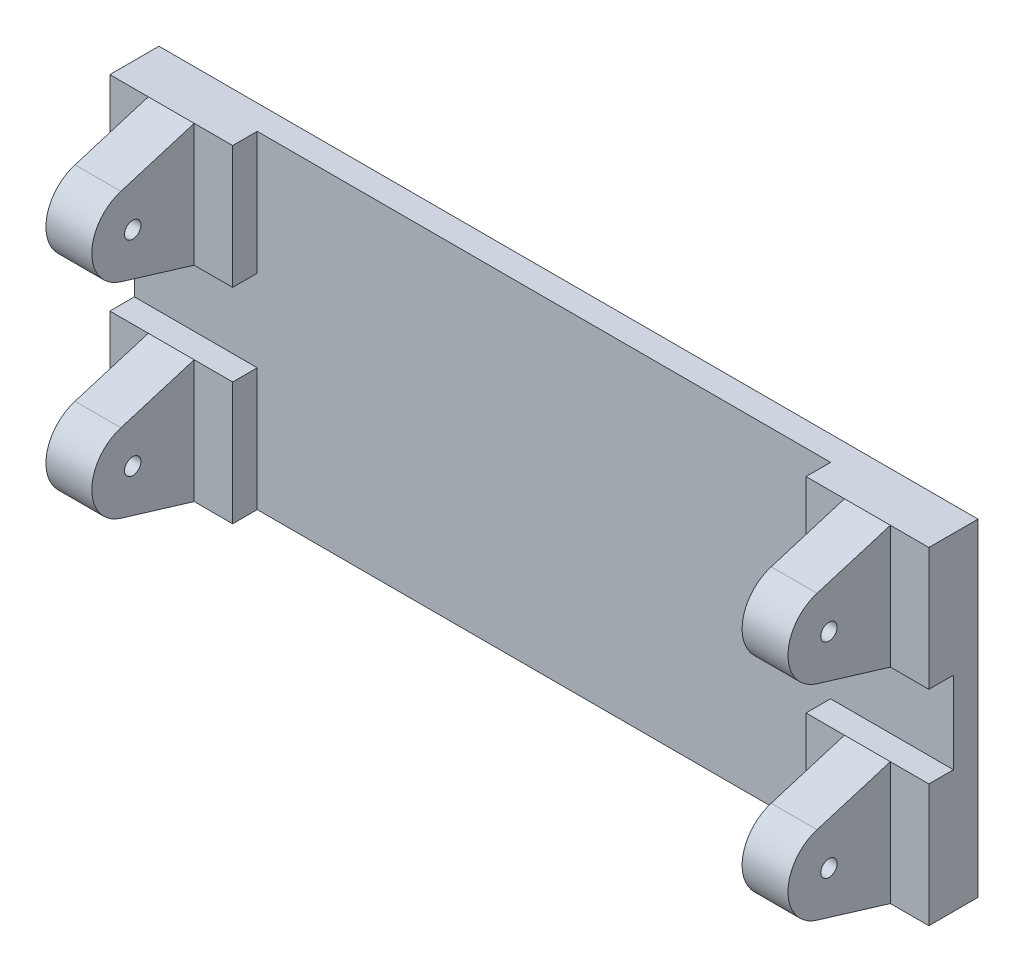
from build123d import *

# Parameters (mm, degrees)
SKETCH1_W               = 100
SKETCH1_H               = 40
BOSS_EXTRUDE1_DEPTH     = 3
SKETCH2_W               = 15
SKETCH2_H               = 15
BOSS_EXTRUDE2_DEPTH     = 3
SKETCH3_R               = 1
BOSS_EXTRUDE3_DEPTH     = 15
CUT_EXTRUDE1_REACH      = 68.65
SKETCH4_W               = 4.7
SKETCH4_H               = 12.5
MIRROR2_COPY_1_SKETCH_R = 1
MIRROR2_COPY_1_DEPTH    = 15
MIRROR2_COPY_2_REACH    = 68.65
MIRROR2_COPY_2_SKETCH_W = 4.7
MIRROR2_COPY_2_SKETCH_H = 12.5


with BuildPart() as part:
    # Sketch1 → Boss-Extrude1 (new body)
    with BuildSketch(Plane.XY):
        Rectangle(SKETCH1_W, SKETCH1_H)
    extrude(amount=BOSS_EXTRUDE1_DEPTH)

    # Sketch2 → Boss-Extrude2 (add)
    with BuildSketch(Plane.XY.offset(3)):
        with Locations((-42.5, 12.5)):
            Rectangle(SKETCH2_W, SKETCH2_H)
        with Locations((-42.5, -12.5)):
            Rectangle(SKETCH2_W, SKETCH2_H)
        with Locations((42.5, -12.5)):
            Rectangle(SKETCH2_W, SKETCH2_H)
        with Locations((42.5, 12.5)):
            Rectangle(SKETCH2_W, SKETCH2_H)
    extrude(amount=BOSS_EXTRUDE2_DEPTH)

    # Sketch3 → Boss-Extrude3 (add)
    with BuildSketch(Plane.ZY.offset(50)):
        with BuildLine():
            Line((6, 5), (14.951381156, 7.715285511))
            ThreePointArc((14.951381156, 7.715285511), (18.5, 12.5), (14.951381156, 17.284714489))
            Line((14.951381156, 17.284714489), (6, 20))
            Line((6, 20), (6, 5))
        make_face()
        with Locations(Location((13.5, 12.5, 0), (0, 0, 270))):
            Circle(SKETCH3_R, mode=Mode.SUBTRACT)
    boss_extrude3 = extrude(amount=-BOSS_EXTRUDE3_DEPTH)

    # Sketch4 → Cut-Extrude1 (cut, up to next)
    with BuildSketch(Plane(origin=(0, 20, 0), x_dir=(1, 0, 0), z_dir=(0, 1, 0)), mode=Mode.PRIVATE) as cut_extrude1_sk1:
        with Locations((-37.35, -12.25)):
            Rectangle(SKETCH4_W, SKETCH4_H)
    cut_extrude1_tool1 = extrude(cut_extrude1_sk1.sketch, amount=-CUT_EXTRUDE1_REACH, mode=Mode.PRIVATE) & part.part
    # Sketch4 → Cut-Extrude1 (cut, up to next)
    with BuildSketch(Plane(origin=(0, 20, 0), x_dir=(1, 0, 0), z_dir=(0, 1, 0)), mode=Mode.PRIVATE) as cut_extrude1_sk2:
        with Locations((-47.65, -12.25)):
            Rectangle(SKETCH4_W, SKETCH4_H)
    cut_extrude1_tool2 = extrude(cut_extrude1_sk2.sketch, amount=-CUT_EXTRUDE1_REACH, mode=Mode.PRIVATE) & part.part
    cut_extrude1_1 = cut_extrude1_tool1.solids().sort_by_distance((-37.35, 20, 12.25))[0]
    add(cut_extrude1_1, mode=Mode.SUBTRACT)
    cut_extrude1_2 = cut_extrude1_tool2.solids().sort_by_distance((-47.65, 20, 12.25))[0]
    add(cut_extrude1_2, mode=Mode.SUBTRACT)
    cut_extrude1 = cut_extrude1_1 + cut_extrude1_2  # Cut-Extrude1 as one shape, for the pattern or mirror that repeats it

    # Mirror1: Boss-Extrude3, Cut-Extrude1 across plane
    add(boss_extrude3.mirror(Plane.ZX))
    add(cut_extrude1.mirror(Plane.ZX), mode=Mode.SUBTRACT)

    # Mirror2: Boss-Extrude3, Cut-Extrude1 across plane
    add(boss_extrude3.mirror(Plane(origin=(0, 0, 0), x_dir=(0, 0, 1), z_dir=(1, 0, 0))))
    add(cut_extrude1.mirror(Plane(origin=(0, 0, 0), x_dir=(0, 0, 1), z_dir=(1, 0, 0))), mode=Mode.SUBTRACT)

    # Mirror2 copy 1 sketch → Mirror2 copy 1 (add)
    with BuildSketch(Plane(origin=(50, 0, 0), x_dir=(0, 0, 1), z_dir=(1, 0, 0))):
        with BuildLine():
            Line((6, 5), (14.951381156, 7.715285511))
            ThreePointArc((14.951381156, 7.715285511), (18.5, 12.5), (14.951381156, 17.284714489))
            Line((14.951381156, 17.284714489), (6, 20))
            Line((6, 20), (6, 5))
        make_face()
        with Locations(Location((13.5, 12.5, 0), (0, 0, 270))):
            Circle(MIRROR2_COPY_1_SKETCH_R, mode=Mode.SUBTRACT)
    extrude(amount=-MIRROR2_COPY_1_DEPTH)

    # Mirror2 copy 2 sketch → Mirror2 copy 2 (cut, up to next)
    with BuildSketch(Plane(origin=(0, -20, 0), x_dir=(-1, 0, 0), z_dir=(0, -1, 0)), mode=Mode.PRIVATE) as mirror2_copy_2_sk1:
        with Locations((-37.35, -12.25)):
            Rectangle(MIRROR2_COPY_2_SKETCH_W, MIRROR2_COPY_2_SKETCH_H)
    mirror2_copy_2_tool1 = extrude(mirror2_copy_2_sk1.sketch, amount=-MIRROR2_COPY_2_REACH, mode=Mode.PRIVATE) & part.part
    # Mirror2 copy 2 sketch → Mirror2 copy 2 (cut, up to next)
    with BuildSketch(Plane(origin=(0, -20, 0), x_dir=(-1, 0, 0), z_dir=(0, -1, 0)), mode=Mode.PRIVATE) as mirror2_copy_2_sk2:
        with Locations((-47.65, -12.25)):
            Rectangle(MIRROR2_COPY_2_SKETCH_W, MIRROR2_COPY_2_SKETCH_H)
    mirror2_copy_2_tool2 = extrude(mirror2_copy_2_sk2.sketch, amount=-MIRROR2_COPY_2_REACH, mode=Mode.PRIVATE) & part.part
    add(mirror2_copy_2_tool1.solids().sort_by_distance((37.35, -20, 12.25))[0], mode=Mode.SUBTRACT)
    add(mirror2_copy_2_tool2.solids().sort_by_distance((47.65, -20, 12.25))[0], mode=Mode.SUBTRACT)


solid = part.part
